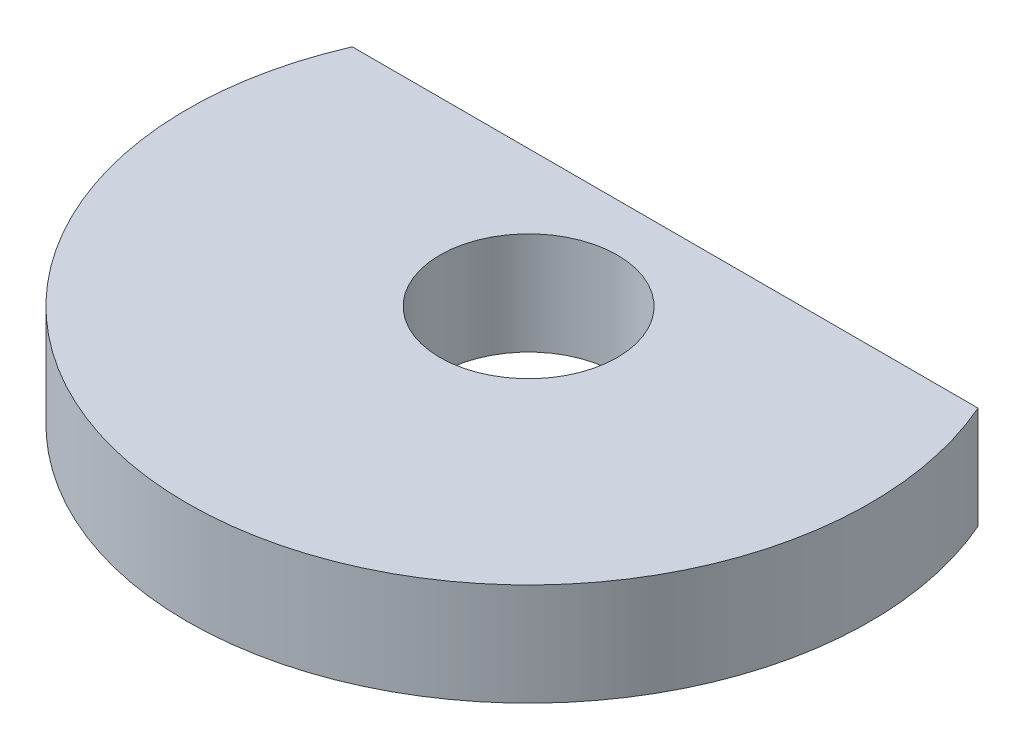
from build123d import *

# Parameters (mm, degrees)
SKETCH_1_R      = 2.6
EXTRUDE_1_DEPTH = 3


with BuildPart() as part:
    # 草图1 → 凸台-拉伸1 (new body)
    with BuildSketch(Plane(origin=(0, 0, 0), x_dir=(1, 0, 0), z_dir=(0, 1, 0))):
        with BuildLine():
            Line((9.16515139, 4), (-9.16515139, 4))
            ThreePointArc((-9.16515139, 4), (-2.043096437, -9.789063129), (10, 0))
            ThreePointArc((10, 0), (9.789063129, 2.043096437), (9.16515139, 4))
        make_face()
        with Locations(Location((0, 0, 0), (0, 0, 270))):
            Circle(SKETCH_1_R, mode=Mode.SUBTRACT)
    extrude(amount=EXTRUDE_1_DEPTH)


solid = part.part
